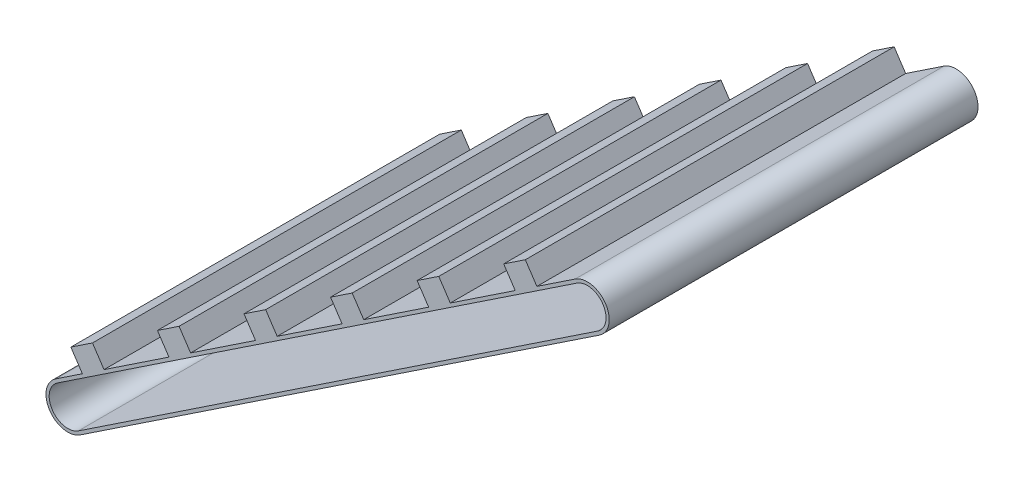
from build123d import *

# Parameters (mm, degrees)
BOSS_EXTRUDE1_DEPTH = 70.9
SKETCH6_W           = 5
SKETCH6_H           = 70.9
BOSS_EXTRUDE2_DEPTH = 4
LPATTERN1_COUNT     = 6
LPATTERN1_PITCH     = 20


with BuildPart() as part:
    # Sketch1 → Boss-Extrude1 (new body)
    with BuildSketch(Plane.XY):
        with BuildLine():
            Line((-2.334965582, 3.503489658), (97.520200597, 70.053814883))
            ThreePointArc((97.520200597, 70.053814883), (103.358655837, 68.885290806), (102.19013176, 63.046835566))
            Line((102.19013176, 63.046835566), (2.334965582, -3.503489658))
            ThreePointArc((2.334965582, -3.503489658), (-3.503489658, -2.334965582), (-2.334965582, 3.503489658))
        make_face()
        with BuildLine():
            Line((-1.996509757, 2.995654985), (97.858656422, 69.54598021))
            ThreePointArc((97.858656422, 69.54598021), (102.850821164, 68.546834981), (101.851675935, 63.554670239))
            Line((101.851675935, 63.554670239), (1.996509757, -2.995654985))
            ThreePointArc((1.996509757, -2.995654985), (-2.995654985, -1.996509757), (-1.996509757, 2.995654985))
        make_face(mode=Mode.SUBTRACT)
    extrude(amount=BOSS_EXTRUDE1_DEPTH)

    # Sketch6 → Boss-Extrude2 (add)
    with BuildSketch(Plane(origin=(-2.334965582, 3.503489658, 0), x_dir=(0.8321263848202342, 0.554586043536986, 0), z_dir=(-0.554586043536986, 0.8321263848202342, 0))):
        with Locations((8.653433918, -35.45)):
            Rectangle(SKETCH6_W, SKETCH6_H)
    boss_extrude2 = extrude(amount=BOSS_EXTRUDE2_DEPTH)

    # LPattern1: Boss-Extrude2 ×6
    with Locations(*[Vector(0.8321263848202339, 0.5545860435369864, 0) * (i * LPATTERN1_PITCH) for i in range(1, LPATTERN1_COUNT)]):
        add(boss_extrude2)


solid = part.part
